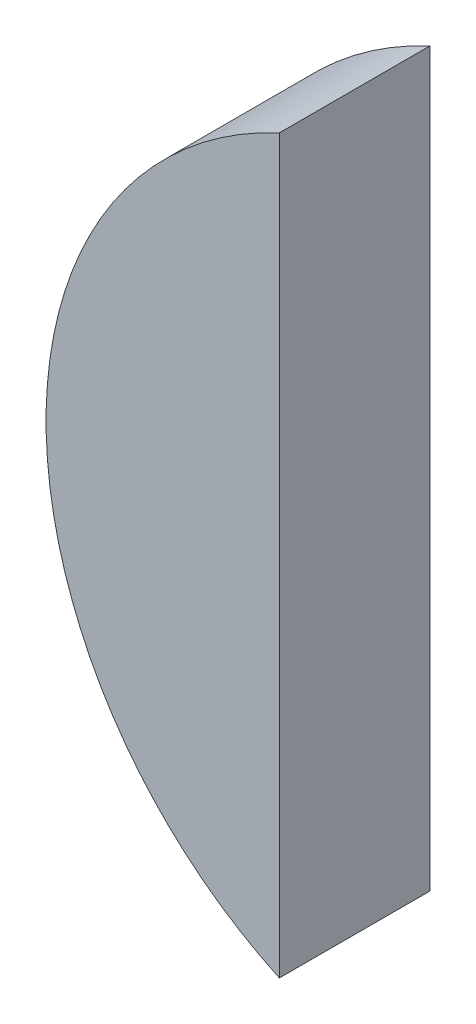
from build123d import *

# Parameters (mm, degrees)
BOSS_EXTRUDE1_DEPTH = 9.525


with BuildPart() as part:
    # Sketch1 → Boss-Extrude1 (new, symmetric)
    with BuildSketch(Plane.XY):
        with BuildLine():
            Line((-21.59, 46.34834681), (-21.59, -46.34834681))
            ThreePointArc((-21.59, -46.34834681), (-51.1302, 0), (-21.59, 46.34834681))
        make_face()
    extrude(amount=BOSS_EXTRUDE1_DEPTH, both=True)


solid = part.part
